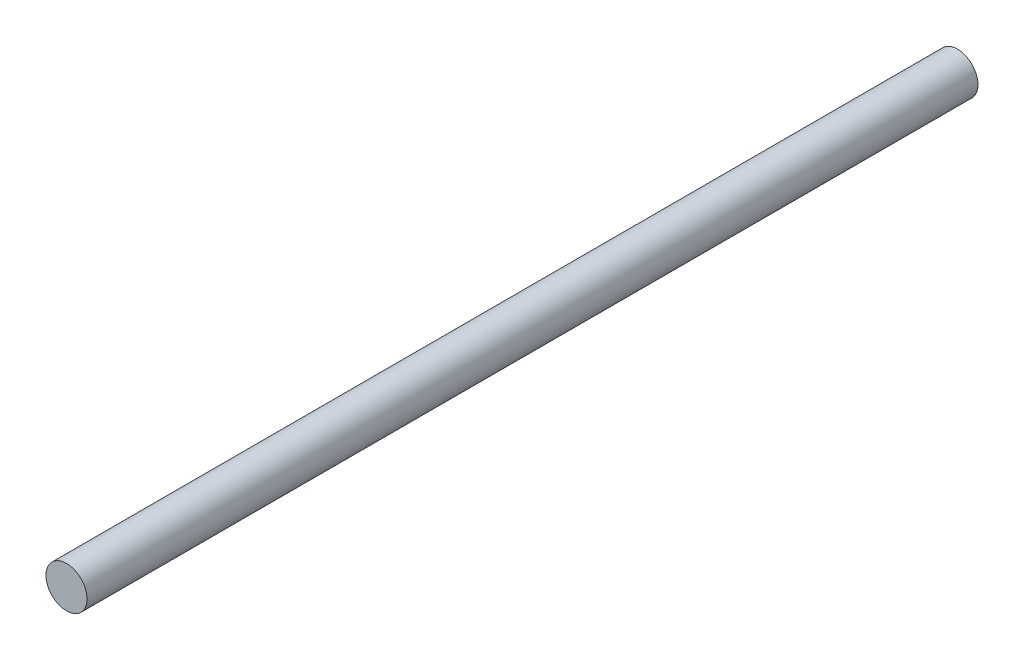
from build123d import *

# Parameters (mm, degrees)
SKETCH1_R           = 3
BOSS_EXTRUDE1_DEPTH = 130


with BuildPart() as part:
    # Sketch1 → Boss-Extrude1 (new body)
    with BuildSketch(Plane.XY):
        Circle(SKETCH1_R)
    extrude(amount=BOSS_EXTRUDE1_DEPTH)


solid = part.part
